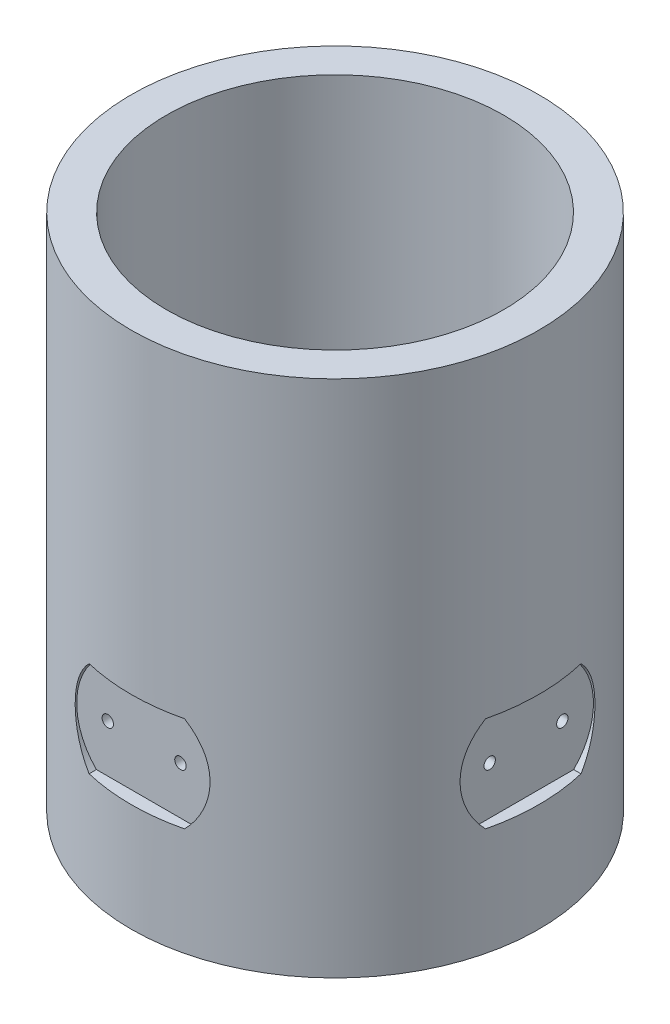
from build123d import *

# Parameters (mm, degrees)
SKETCH2_R           = 39.3
SKETCH2_R_2         = 32.5
BOSS_EXTRUDE1_DEPTH = 100
CUT_EXTRUDE1_START  = 39.3
CUT_EXTRUDE1_DEPTH  = 2.5
SKETCH4_R           = 1.1
CUT_EXTRUDE2_DEPTH  = 3
CIRPATTERN1_COUNT   = 4


with BuildPart() as part:
    # Sketch2 → Boss-Extrude1 (new body)
    with BuildSketch(Plane(origin=(0, 0, 0), x_dir=(1, 0, 0), z_dir=(0, 1, 0))):
        Circle(SKETCH2_R)
        Circle(SKETCH2_R_2, mode=Mode.SUBTRACT)
    extrude(amount=BOSS_EXTRUDE1_DEPTH)

    # Sketch3 → Cut-Extrude1 (cut)
    with BuildSketch(Plane.XY.offset(CUT_EXTRUDE1_START)):
        with BuildLine():
            Line((9.192388155, 39.192388155), (-9.192388155, 39.192388155))
            ThreePointArc((-9.192388155, 39.192388155), (-13, 30), (-9.192388155, 20.807611845))
            Line((-9.192388155, 20.807611845), (9.192388155, 20.807611845))
            ThreePointArc((9.192388155, 20.807611845), (13, 30), (9.192388155, 39.192388155))
        make_face()
    cut_extrude1 = extrude(amount=-CUT_EXTRUDE1_DEPTH, mode=Mode.SUBTRACT)

    # Sketch4 → Cut-Extrude2 (cut)
    with BuildSketch(Plane.XY.offset(36.8)):
        with Locations((7, 30)):
            Circle(SKETCH4_R)
        with Locations((-7, 30)):
            Circle(SKETCH4_R)
    cut_extrude2 = extrude(amount=-CUT_EXTRUDE2_DEPTH, mode=Mode.SUBTRACT)

    # CirPattern1: Cut-Extrude1, Cut-Extrude2 ×4 about axis
    cirpattern1_axis = Axis((0, 100, 0), (0, -1, 0))
    add([cut_extrude1.rotate(cirpattern1_axis, i * 360 / CIRPATTERN1_COUNT) for i in range(1, CIRPATTERN1_COUNT)], mode=Mode.SUBTRACT)
    add([cut_extrude2.rotate(cirpattern1_axis, i * 360 / CIRPATTERN1_COUNT) for i in range(1, CIRPATTERN1_COUNT)], mode=Mode.SUBTRACT)


solid = part.part
